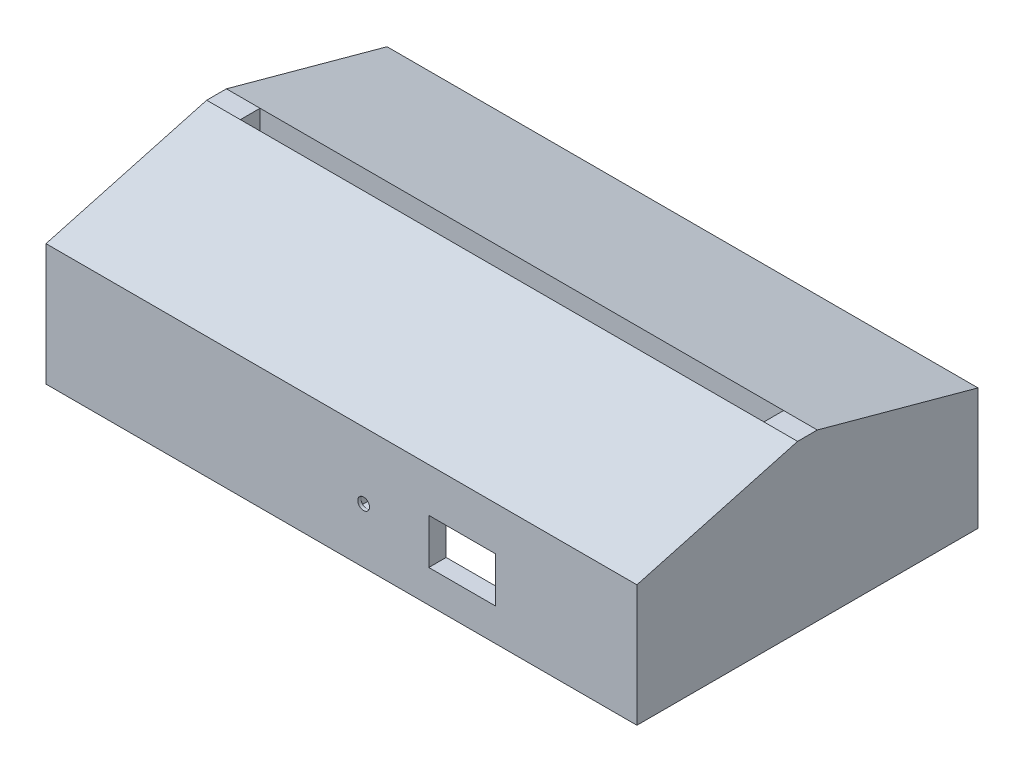
from build123d import *

# Parameters (mm, degrees)
SKETCH1_W            = 172.72
SKETCH1_H            = 99.695
BOSS_EXTRUDE1_DEPTH  = 38.1
SKETCH2_W            = 162.56
SKETCH2_H            = 89.535
CUT_EXTRUDE1_DEPTH   = 31.75
SKETCH3_W            = 6.35
SKETCH3_H            = 6.35
BOSS_EXTRUDE2_DEPTH  = 26.67
SKETCH7_R            = 1.5875
CUT_EXTRUDE3_DEPTH   = 26.67
SKETCH8_W            = 19.558
SKETCH8_H            = 13.208
CUT_EXTRUDE4_DEPTH   = 5.08
SKETCH9_R            = 1.7145
CUT_EXTRUDE6_DEPTH   = 3.4544
SKETCH11_W           = 6.2992
SKETCH11_H           = 12.192
CUT_EXTRUDE7_DEPTH   = 1.6256
SKETCH14_W           = 6.2992
SKETCH14_H           = 3.556
BOSS_EXTRUDE3_DEPTH  = 2.4384
SKETCH22_W           = 3.429
SKETCH22_H           = 10.8585
CUT_EXTRUDE8_DEPTH   = 2.54
BOSS_EXTRUDE16_DEPTH = 2.54
BOSS_EXTRUDE18_DEPTH = 2.54
SKETCH28_W           = 2.54
SKETCH28_H           = 6.096
BOSS_EXTRUDE19_DEPTH = 1.2065
SKETCH29_W           = 2.54
SKETCH29_H           = 6.096
BOSS_EXTRUDE20_DEPTH = 1.2065
CUT_EXTRUDE12_DEPTH  = 7.0485
SKETCH33_W           = 172.72
SKETCH33_H           = 2.54
CUT_EXTRUDE13_DEPTH  = 138.29075943
SKETCH36_W           = 172.72
SKETCH36_H           = 46.9646
BOSS_EXTRUDE21_DEPTH = 12.827
CUT_EXTRUDE14_DEPTH  = 187.167326417
SKETCH41_W           = 9.8425
SKETCH41_H           = 5.7658
BOSS_EXTRUDE22_DEPTH = 12.827
SKETCH42_R           = 2.2225
CUT_EXTRUDE15_DEPTH  = 106.864708266
SKETCH44_W           = 8.6614
SKETCH44_H           = 5.08
BOSS_EXTRUDE24_DEPTH = 10.541
SKETCH46_W           = 1.524
SKETCH46_H           = 10.541
BOSS_EXTRUDE25_DEPTH = 5.6134
SKETCH48_W           = 5.6134
SKETCH48_H           = 1.905
BOSS_EXTRUDE26_DEPTH = 1.27
SKETCH49_W           = 5.6134
SKETCH49_H           = 1.905
BOSS_EXTRUDE27_DEPTH = 1.27
SKETCH50_W           = 5.6134
SKETCH50_H           = 1.905
BOSS_EXTRUDE28_DEPTH = 1.27
SKETCH51_W           = 5.6134
SKETCH51_H           = 1.905
BOSS_EXTRUDE29_DEPTH = 1.27
SKETCH52_W           = 5.6134
SKETCH52_H           = 1.905
BOSS_EXTRUDE30_DEPTH = 1.27
SKETCH53_W           = 5.6134
SKETCH53_H           = 1.905
BOSS_EXTRUDE31_DEPTH = 1.27
SKETCH54_W           = 5.6134
SKETCH54_H           = 1.905
BOSS_EXTRUDE32_DEPTH = 1.27
SKETCH55_W           = 5.6134
SKETCH55_H           = 1.905
BOSS_EXTRUDE33_DEPTH = 1.27
SKETCH56_W           = 5.6134
SKETCH56_H           = 1.905
BOSS_EXTRUDE34_DEPTH = 1.27
SKETCH57_W           = 5.6134
SKETCH57_H           = 1.905
BOSS_EXTRUDE35_DEPTH = 1.27
SKETCH58_W           = 5.6134
SKETCH58_H           = 1.905
BOSS_EXTRUDE36_DEPTH = 1.27
SKETCH59_W           = 5.6134
SKETCH59_H           = 1.905
BOSS_EXTRUDE37_DEPTH = 1.27


with BuildPart() as part:
    # Sketch1 → Boss-Extrude1 (new body)
    with BuildSketch(Plane(origin=(0, 0, 0), x_dir=(1, 0, 0), z_dir=(0, 1, 0))):
        Rectangle(SKETCH1_W, SKETCH1_H)
    extrude(amount=BOSS_EXTRUDE1_DEPTH)

    # Sketch2 → Cut-Extrude1 (cut)
    with BuildSketch(Plane.XZ):
        Rectangle(SKETCH2_W, SKETCH2_H)
    extrude(amount=-CUT_EXTRUDE1_DEPTH, mode=Mode.SUBTRACT)

    # Sketch3 → Boss-Extrude2 (add)
    with BuildSketch(Plane.XZ.offset(-31.75)):
        with Locations((-78.105, 41.5925)):
            Rectangle(SKETCH3_W, SKETCH3_H)
        with Locations((78.105, -41.5925)):
            Rectangle(SKETCH3_W, SKETCH3_H)
    extrude(amount=BOSS_EXTRUDE2_DEPTH)

    # Sketch7 → Cut-Extrude3 (cut)
    with BuildSketch(Plane.XZ.offset(-5.08)):
        with Locations(Location((-78.105, 41.5925, 0), (0, 0, 270))):
            Circle(SKETCH7_R)
        with Locations(Location((78.105, -41.5925, 0), (0, 0, 270))):
            Circle(SKETCH7_R)
    extrude(amount=-CUT_EXTRUDE3_DEPTH, mode=Mode.SUBTRACT)

    # Sketch8 → Cut-Extrude4 (cut)
    with BuildSketch(Plane.XY.offset(49.8475)):
        with Locations((35.306, 16.129)):
            Rectangle(SKETCH8_W, SKETCH8_H)
    extrude(amount=-CUT_EXTRUDE4_DEPTH, mode=Mode.SUBTRACT)

    # Sketch9 → Cut-Extrude6 (cut)
    with BuildSketch(Plane.XY.offset(49.8475)):
        with Locations((6.477, 16.129)):
            Circle(SKETCH9_R)
    extrude(amount=-CUT_EXTRUDE6_DEPTH, mode=Mode.SUBTRACT)

    # Sketch11 → Cut-Extrude7 (cut)
    with BuildSketch(Plane(origin=(0, 0, 44.7675), x_dir=(-1, 0, 0), z_dir=(0, 0, -1))):
        with Locations((-6.477, 19.177)):
            Rectangle(SKETCH11_W, SKETCH11_H)
    extrude(amount=-CUT_EXTRUDE7_DEPTH, mode=Mode.SUBTRACT)

    # Sketch14 → Boss-Extrude3 (add)
    with BuildSketch(Plane(origin=(0, 0, 44.7675), x_dir=(-1, 0, 0), z_dir=(0, 0, -1))):
        Polygon((-9.6266, 9.525), (-9.6266, 13.081), (-9.6266, 19.177), (-13.1826, 19.177), (-13.1826, 9.525), align=None)
        with Locations((-6.477, 11.303)):
            Rectangle(SKETCH14_W, SKETCH14_H)
        Polygon((-3.3274, 19.177), (-3.3274, 13.081), (-3.3274, 9.525), (0.2286, 9.525), (0.2286, 19.177), align=None)
    extrude(amount=BOSS_EXTRUDE3_DEPTH)

    # Sketch22 → Cut-Extrude8 (cut)
    with BuildSketch(Plane(origin=(0, 0, 46.3931), x_dir=(-1, 0, 0), z_dir=(0, 0, -1))):
        with Locations((-6.477, 19.84375)):
            Rectangle(SKETCH22_W, SKETCH22_H)
    extrude(amount=-CUT_EXTRUDE8_DEPTH, mode=Mode.SUBTRACT)

    # Sketch25 → Boss-Extrude16 (add)
    with BuildSketch(Plane(origin=(0, 0, 42.3291), x_dir=(-1, 0, 0), z_dir=(0, 0, -1))):
        Polygon((-9.9441, 13.081), (-9.6266, 13.081), (-9.6266, 19.177), (-11.4046, 19.177), (-11.4046, 13.081), align=None)
        Polygon((-3.3274, 19.177), (-3.3274, 13.081), (-3.0734, 13.081), (-3.0099, 13.081), (-1.5494, 13.081), (-1.5494, 19.177), align=None)
    extrude(amount=BOSS_EXTRUDE16_DEPTH)

    # Sketch25<7> → Boss-Extrude18 (add)
    with BuildSketch(Plane(origin=(0, 0, 42.3291), x_dir=(-1, 0, 0), z_dir=(0, 0, -1))):
        Polygon((-8.4201, 11.811), (-8.4201, 13.081), (-9.6266, 13.081), (-9.9441, 13.081), (-9.9441, 11.811), align=None)
        Polygon((-3.3274, 13.081), (-4.5339, 13.081), (-4.5339, 11.811), (-3.0099, 11.811), (-3.0099, 13.081), (-3.0734, 13.081), align=None)
    extrude(amount=BOSS_EXTRUDE18_DEPTH)

    # Sketch28 → Boss-Extrude19 (add)
    with BuildSketch(Plane(origin=(3.3274, 0, 0), x_dir=(0, 0, -1), z_dir=(1, 0, 0))):
        with Locations((-41.0591, 16.129)):
            Rectangle(SKETCH28_W, SKETCH28_H)
    extrude(amount=BOSS_EXTRUDE19_DEPTH)

    # Sketch29 → Boss-Extrude20 (add)
    with BuildSketch(Plane.ZY.offset(-9.6266)):
        with Locations((41.0591, 16.129)):
            Rectangle(SKETCH29_W, SKETCH29_H)
    extrude(amount=BOSS_EXTRUDE20_DEPTH)

    # Sketch30 → Cut-Extrude12 (cut)
    with BuildSketch(Plane(origin=(9.9441, 0, 0), x_dir=(0, 0, -1), z_dir=(1, 0, 0))):
        Polygon((-39.7891, 13.081), (-42.3291, 11.811), (-39.7891, 11.811), align=None)
    extrude(amount=-CUT_EXTRUDE12_DEPTH, mode=Mode.SUBTRACT)

    # Sketch33 → Cut-Extrude13 (cut, through all)
    with BuildSketch(Plane.XY.offset(49.8475)):
        with Locations((0, 36.83)):
            Rectangle(SKETCH33_W, SKETCH33_H)
    extrude(amount=-CUT_EXTRUDE13_DEPTH, mode=Mode.SUBTRACT)

    # Sketch36 → Boss-Extrude21 (add)
    with BuildSketch(Plane(origin=(0, 35.56, 0), x_dir=(1, 0, 0), z_dir=(0, 1, 0))):
        with Locations((0, 26.3652)):
            Rectangle(SKETCH36_W, SKETCH36_H)
        with Locations((0, -26.3652)):
            Rectangle(SKETCH36_W, SKETCH36_H)
    extrude(amount=BOSS_EXTRUDE21_DEPTH)

    # Sketch37 → Cut-Extrude14 (cut, through all)
    with BuildSketch(Plane.ZY.offset(86.36)):
        Polygon((-49.8475, 35.56), (-49.8475, 48.387), (-2.8829, 48.387), align=None)
        Polygon((2.8829, 48.387), (49.8475, 35.56), (49.8475, 48.387), align=None)
    extrude(amount=-CUT_EXTRUDE14_DEPTH, mode=Mode.SUBTRACT)

    # Sketch41 → Boss-Extrude22 (add, through all)
    with BuildSketch(Plane(origin=(0, 35.56, 0), x_dir=(1, 0, 0), z_dir=(0, 1, 0))):
        with Locations((-81.43875, 0)):
            Rectangle(SKETCH41_W, SKETCH41_H)
        with Locations((81.43875, 0)):
            Rectangle(SKETCH41_W, SKETCH41_H)
    extrude(amount=BOSS_EXTRUDE22_DEPTH)

    # Sketch42 → Cut-Extrude15 (cut, through all)
    with BuildSketch(Plane(origin=(0, 35.56, 0), x_dir=(1, 0, 0), z_dir=(0, 1, 0))):
        with Locations(Location((-63.8175, 0, 0), (0, 0, 270))):
            Circle(SKETCH42_R)
        with Locations(Location((63.8175, 0, 0), (0, 0, 270))):
            Circle(SKETCH42_R)
        with Locations(Location((-38.4175, 0, 0), (0, 0, 270))):
            Circle(SKETCH42_R)
        with Locations(Location((-13.0175, 0, 0), (0, 0, 270))):
            Circle(SKETCH42_R)
        with Locations(Location((12.3825, 0, 0), (0, 0, 270))):
            Circle(SKETCH42_R)
        with Locations(Location((37.7825, 0, 0), (0, 0, 270))):
            Circle(SKETCH42_R)
    extrude(amount=-CUT_EXTRUDE15_DEPTH, mode=Mode.SUBTRACT)

    # Sketch44 → Boss-Extrude24 (add)
    with BuildSketch(Plane(origin=(0, 31.75, 0), x_dir=(-1, 0, 0), z_dir=(0, -1, 0))):
        with Locations((38.4175, -4.7625)):
            Rectangle(SKETCH44_W, SKETCH44_H)
        with Locations((63.8175, -4.7625)):
            Rectangle(SKETCH44_W, SKETCH44_H)
        with Locations((13.0175, -4.7625)):
            Rectangle(SKETCH44_W, SKETCH44_H)
        with Locations((-12.3825, -4.7625)):
            Rectangle(SKETCH44_W, SKETCH44_H)
        with Locations((-37.7825, -4.7625)):
            Rectangle(SKETCH44_W, SKETCH44_H)
        with Locations((-63.9445, -4.7625)):
            Rectangle(SKETCH44_W, SKETCH44_H)
    extrude(amount=BOSS_EXTRUDE24_DEPTH)

    # Sketch46 → Boss-Extrude25 (add)
    with BuildSketch(Plane(origin=(0, 0, 2.2225), x_dir=(-1, 0, 0), z_dir=(0, 0, -1))):
        with Locations((67.3862, 26.4795)):
            Rectangle(SKETCH46_W, SKETCH46_H)
        with Locations((41.9862, 26.4795)):
            Rectangle(SKETCH46_W, SKETCH46_H)
        with Locations((60.2488, 26.4795)):
            Rectangle(SKETCH46_W, SKETCH46_H)
        with Locations((34.8488, 26.4795)):
            Rectangle(SKETCH46_W, SKETCH46_H)
        with Locations((16.5862, 26.4795)):
            Rectangle(SKETCH46_W, SKETCH46_H)
        with Locations((9.4488, 26.4795)):
            Rectangle(SKETCH46_W, SKETCH46_H)
        with Locations((-8.8138, 26.4795)):
            Rectangle(SKETCH46_W, SKETCH46_H)
        with Locations((-15.9512, 26.4795)):
            Rectangle(SKETCH46_W, SKETCH46_H)
        with Locations((-34.2138, 26.4795)):
            Rectangle(SKETCH46_W, SKETCH46_H)
        with Locations((-41.3512, 26.4795)):
            Rectangle(SKETCH46_W, SKETCH46_H)
        with Locations((-60.3758, 26.4795)):
            Rectangle(SKETCH46_W, SKETCH46_H)
        with Locations((-67.5132, 26.4795)):
            Rectangle(SKETCH46_W, SKETCH46_H)
    extrude(amount=BOSS_EXTRUDE25_DEPTH)

    # Sketch48 → Boss-Extrude26 (add)
    with BuildSketch(Plane.ZY.offset(-66.7512)):
        with Locations((-0.5842, 22.1615)):
            Rectangle(SKETCH48_W, SKETCH48_H)
    extrude(amount=BOSS_EXTRUDE26_DEPTH)

    # Sketch49 → Boss-Extrude27 (add)
    with BuildSketch(Plane(origin=(61.1378, 0, 0), x_dir=(0, 0, -1), z_dir=(1, 0, 0))):
        with Locations((0.5842, 22.1615)):
            Rectangle(SKETCH49_W, SKETCH49_H)
    extrude(amount=BOSS_EXTRUDE27_DEPTH)

    # Sketch50 → Boss-Extrude28 (add)
    with BuildSketch(Plane.ZY.offset(-40.5892)):
        with Locations((-0.5842, 22.1615)):
            Rectangle(SKETCH50_W, SKETCH50_H)
    extrude(amount=BOSS_EXTRUDE28_DEPTH)

    # Sketch51 → Boss-Extrude29 (add)
    with BuildSketch(Plane(origin=(34.9758, 0, 0), x_dir=(0, 0, -1), z_dir=(1, 0, 0))):
        with Locations((0.5842, 22.1615)):
            Rectangle(SKETCH51_W, SKETCH51_H)
    extrude(amount=BOSS_EXTRUDE29_DEPTH)

    # Sketch52 → Boss-Extrude30 (add)
    with BuildSketch(Plane.ZY.offset(-15.1892)):
        with Locations((-0.5842, 22.1615)):
            Rectangle(SKETCH52_W, SKETCH52_H)
    extrude(amount=BOSS_EXTRUDE30_DEPTH)

    # Sketch53 → Boss-Extrude31 (add)
    with BuildSketch(Plane(origin=(9.5758, 0, 0), x_dir=(0, 0, -1), z_dir=(1, 0, 0))):
        with Locations((0.5842, 22.1615)):
            Rectangle(SKETCH53_W, SKETCH53_H)
    extrude(amount=BOSS_EXTRUDE31_DEPTH)

    # Sketch54 → Boss-Extrude32 (add)
    with BuildSketch(Plane.ZY.offset(10.2108)):
        with Locations((-0.5842, 22.1615)):
            Rectangle(SKETCH54_W, SKETCH54_H)
    extrude(amount=BOSS_EXTRUDE32_DEPTH)

    # Sketch55 → Boss-Extrude33 (add)
    with BuildSketch(Plane(origin=(-15.8242, 0, 0), x_dir=(0, 0, -1), z_dir=(1, 0, 0))):
        with Locations((0.5842, 22.1615)):
            Rectangle(SKETCH55_W, SKETCH55_H)
    extrude(amount=BOSS_EXTRUDE33_DEPTH)

    # Sketch56 → Boss-Extrude34 (add)
    with BuildSketch(Plane.ZY.offset(35.6108)):
        with Locations((-0.5842, 22.1615)):
            Rectangle(SKETCH56_W, SKETCH56_H)
    extrude(amount=BOSS_EXTRUDE34_DEPTH)

    # Sketch57 → Boss-Extrude35 (add)
    with BuildSketch(Plane(origin=(-41.2242, 0, 0), x_dir=(0, 0, -1), z_dir=(1, 0, 0))):
        with Locations((0.5842, 22.1615)):
            Rectangle(SKETCH57_W, SKETCH57_H)
    extrude(amount=BOSS_EXTRUDE35_DEPTH)

    # Sketch58 → Boss-Extrude36 (add)
    with BuildSketch(Plane.ZY.offset(61.0108)):
        with Locations((-0.5842, 22.1615)):
            Rectangle(SKETCH58_W, SKETCH58_H)
    extrude(amount=BOSS_EXTRUDE36_DEPTH)

    # Sketch59 → Boss-Extrude37 (add)
    with BuildSketch(Plane(origin=(-66.6242, 0, 0), x_dir=(0, 0, -1), z_dir=(1, 0, 0))):
        with Locations((0.5842, 22.1615)):
            Rectangle(SKETCH59_W, SKETCH59_H)
    extrude(amount=BOSS_EXTRUDE37_DEPTH)


solid = part.part
